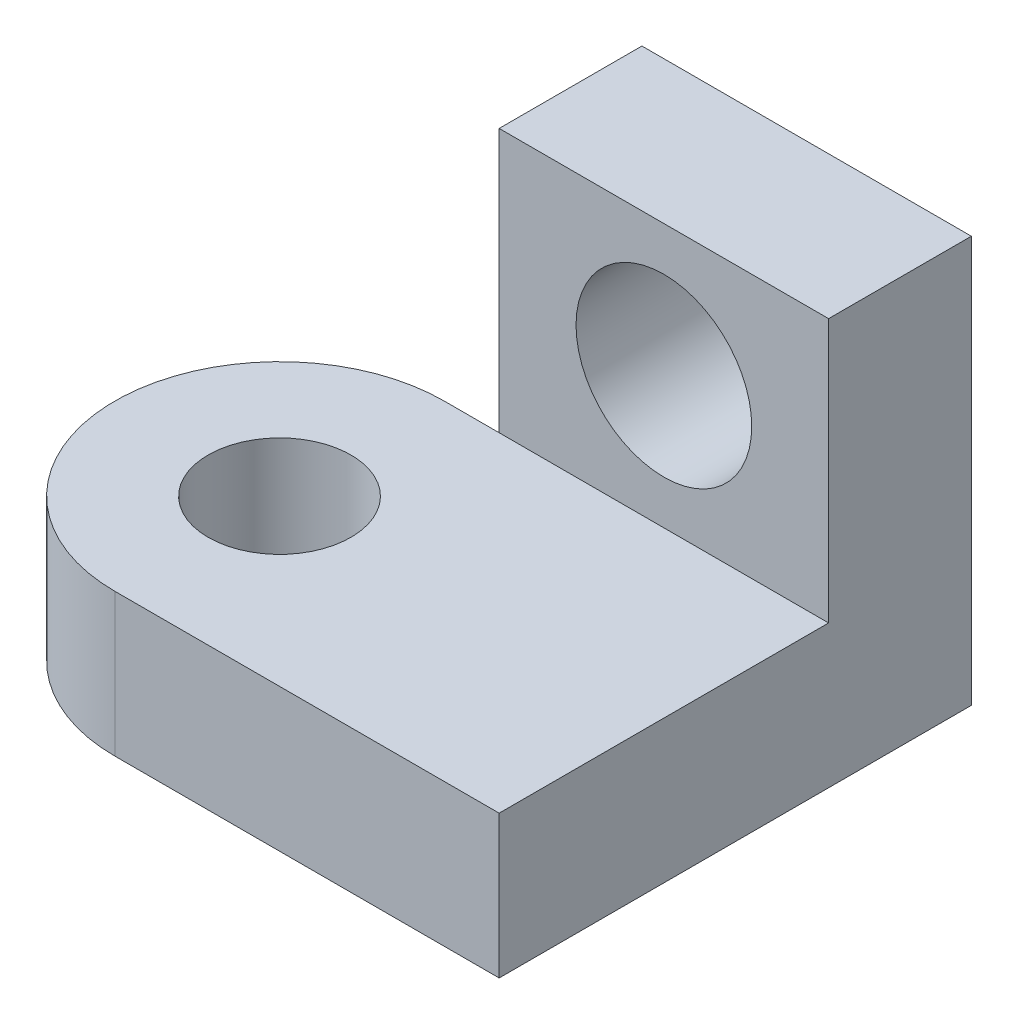
from build123d import *

# Parameters (mm, degrees)
ESBO_O1_W                = 30
ESBO_O1_H                = 24
ESBO_O1_R                = 8
RESSALTO_EXTRUS_O3_DEPTH = 13
ESBO_O5_W                = 13
ESBO_O5_H                = 13
RESSALTO_EXTRUS_O4_DEPTH = 30
RESSALTO_EXTRUS_O6_DEPTH = 13
ESBO_O8_R                = 6.5
CORTE_EXTRUS_O1_DEPTH    = 13


with BuildPart() as part:
    # Esboço1 → Ressalto-extrusão3 (new body)
    with BuildSketch(Plane.XY):
        with Locations((15, 12)):
            Rectangle(ESBO_O1_W, ESBO_O1_H)
        with Locations(Location((15, 12, 0), (0, 0, 180))):
            Circle(ESBO_O1_R, mode=Mode.SUBTRACT)
    extrude(amount=RESSALTO_EXTRUS_O3_DEPTH)

    # Esboço5 → Ressalto-extrusão4 (add)
    with BuildSketch(Plane.ZY):
        with Locations((6.5, -6.5)):
            Rectangle(ESBO_O5_W, ESBO_O5_H)
    extrude(amount=-RESSALTO_EXTRUS_O4_DEPTH)

    # Esboço7 → Ressalto-extrusão6 (add)
    with BuildSketch(Plane.XZ.offset(13)):
        with BuildLine():
            Line((-5, 13), (30, 13))
            Line((30, 13), (30, 42.99999773))
            Line((30, 42.99999773), (-5, 42.99999773))
            ThreePointArc((-5, 42.99999773), (-19.999998865, 27.999998865), (-5, 13))
        make_face()
    extrude(amount=-RESSALTO_EXTRUS_O6_DEPTH)

    # Esboço8 → Corte-extrusão1 (cut)
    with BuildSketch(Plane(origin=(0, 0, 0), x_dir=(1, 0, 0), z_dir=(0, 1, 0))):
        with Locations(Location((-5, -27.999998865, 0), (0, 0, 270))):
            Circle(ESBO_O8_R)
    extrude(amount=-CORTE_EXTRUS_O1_DEPTH, mode=Mode.SUBTRACT)


solid = part.part
